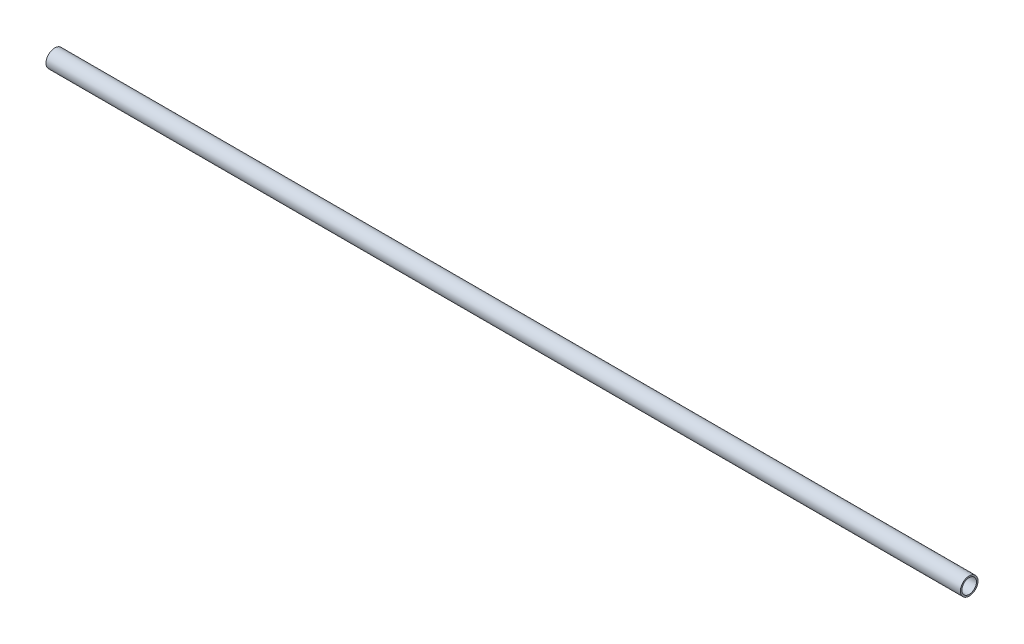
from build123d import *

# Parameters (mm, degrees)
SKETCH1_R           = 9.525
SKETCH1_R_2         = 7.874
BOSS_EXTRUDE1_DEPTH = 495.3


with BuildPart() as part:
    # Sketch1 → Boss-Extrude1 (new, symmetric)
    with BuildSketch(Plane(origin=(0, 0, 0), x_dir=(0, 0, -1), z_dir=(1, 0, 0))):
        Circle(SKETCH1_R)
        Circle(SKETCH1_R_2, mode=Mode.SUBTRACT)
    extrude(amount=BOSS_EXTRUDE1_DEPTH, both=True)


solid = part.part
